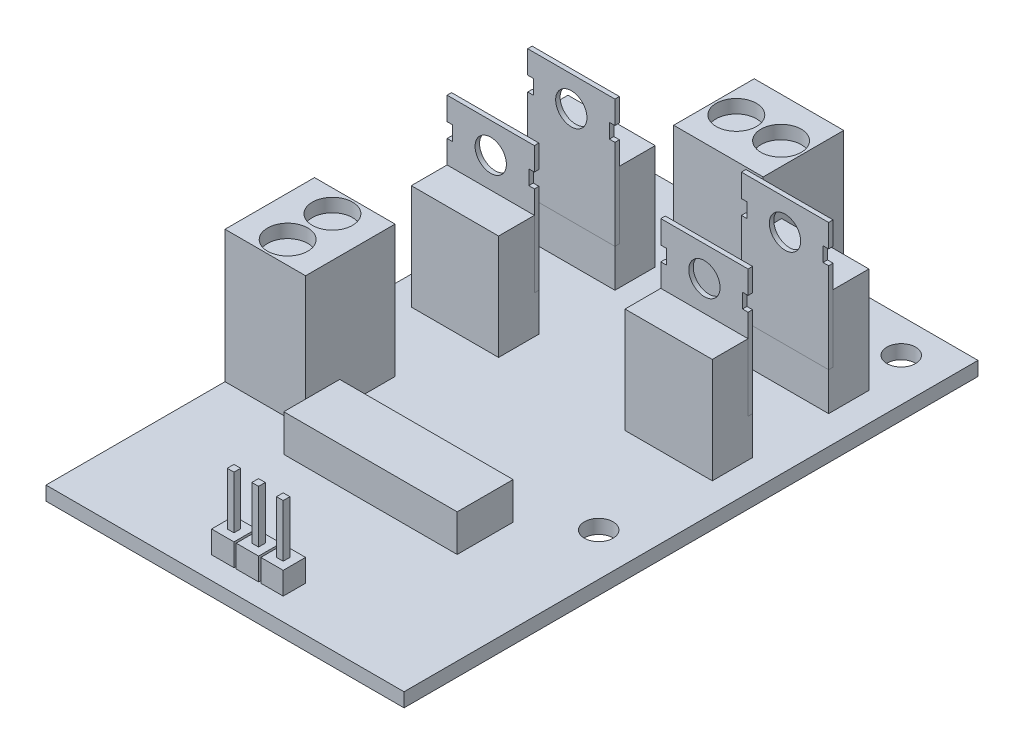
from build123d import *

# Parameters (mm, degrees)
SKETCH1_W           = 40.64
SKETCH1_H           = 65.151
BOSS_EXTRUDE1_DEPTH = 1.5875
SKETCH2_R           = 1.6256
CUT_EXTRUDE1_DEPTH  = 39.426367985
SKETCH3_W           = 9.144
SKETCH3_H           = 10.16
SKETCH3_R           = 2.286
SKETCH3_W_2         = 10.16
SKETCH3_H_2         = 9.144
BOSS_EXTRUDE2_DEPTH = 14.986
CUT_EXTRUDE2_START  = 14.986
SKETCH3_3_R         = 2.286
CUT_EXTRUDE2_DEPTH  = 1.524
SKETCH4_W           = 9.906
SKETCH4_H           = 4.572
BOSS_EXTRUDE3_DEPTH = 11.938
SKETCH5_W           = 9.906
SKETCH5_H           = 7.62
BOSS_EXTRUDE4_DEPTH = 0.508
SKETCH5_3_W         = 9.906
SKETCH5_3_H         = 7.62
CUT_EXTRUDE3_DEPTH  = 0.508
SKETCH6_W           = 2.54
SKETCH6_H           = 2.54
BOSS_EXTRUDE5_DEPTH = 2.54
SKETCH7_W           = 0.762
SKETCH7_H           = 0.762
BOSS_EXTRUDE6_DEPTH = 5.969
SKETCH8_W           = 19.685
SKETCH8_H           = 6.35
BOSS_EXTRUDE7_DEPTH = 4.191


with BuildPart() as part:
    # Sketch1 → Boss-Extrude1 (new body)
    with BuildSketch(Plane(origin=(0, 0, 0), x_dir=(1, 0, 0), z_dir=(0, 1, 0))):
        Rectangle(SKETCH1_W, SKETCH1_H)
    extrude(amount=BOSS_EXTRUDE1_DEPTH)

    # Sketch2 → Cut-Extrude1 (cut, through all)
    with BuildSketch(Plane(origin=(0, 1.5875, 0), x_dir=(1, 0, 0), z_dir=(0, 1, 0))):
        with Locations(Location((-15.0114, 28.7147, 0), (0, 0, 270))):
            Circle(SKETCH2_R)
        with Locations(Location((15.4686, 28.7147, 0), (0, 0, 270))):
            Circle(SKETCH2_R)
        with Locations(Location((15.4686, -5.6261, 0), (0, 0, 270))):
            Circle(SKETCH2_R)
    extrude(amount=-CUT_EXTRUDE1_DEPTH, mode=Mode.SUBTRACT)

    # Sketch6 → Boss-Extrude5 (add)
    with BuildSketch(Plane(origin=(0, 1.5875, 0), x_dir=(1, 0, 0), z_dir=(0, 1, 0))):
        with Locations((0, -28.7655)):
            Rectangle(SKETCH6_W, SKETCH6_H)
        with Locations((2.794, -28.7655)):
            Rectangle(SKETCH6_W, SKETCH6_H)
        with Locations((-2.794, -28.7655)):
            Rectangle(SKETCH6_W, SKETCH6_H)
    extrude(amount=BOSS_EXTRUDE5_DEPTH)

    # Sketch7 → Boss-Extrude6 (add)
    with BuildSketch(Plane(origin=(0, 4.1275, 0), x_dir=(1, 0, 0), z_dir=(0, 1, 0))):
        with Locations((-2.794, -28.7655)):
            Rectangle(SKETCH7_W, SKETCH7_H)
        with Locations((0, -28.7655)):
            Rectangle(SKETCH7_W, SKETCH7_H)
        with Locations((2.794, -28.7655)):
            Rectangle(SKETCH7_W, SKETCH7_H)
    extrude(amount=BOSS_EXTRUDE6_DEPTH)

    # Sketch8 → Boss-Extrude7 (add)
    with BuildSketch(Plane(origin=(0, 1.5875, 0), x_dir=(1, 0, 0), z_dir=(0, 1, 0))):
        with Locations((0, -12.8905)):
            Rectangle(SKETCH8_W, SKETCH8_H)
    extrude(amount=BOSS_EXTRUDE7_DEPTH)


with BuildPart() as body_2:
    # Sketch3 → Boss-Extrude2 (new body)
    # profile 1 of 6: a face of its own
    with BuildSketch(Plane(origin=(0, 1.5875, 0), x_dir=(1, 0, 0), z_dir=(0, 1, 0))):
        with Locations((-15.748, -7.1755)):
            Rectangle(SKETCH3_W, SKETCH3_H)
        with Locations((-15.748, -9.7155)):
            Circle(SKETCH3_R, mode=Mode.SUBTRACT)
        with Locations((-15.748, -4.6355)):
            Circle(SKETCH3_R, mode=Mode.SUBTRACT)
    # profile 2 of 6: a face of its own
    with BuildSketch(Plane(origin=(0, 1.5875, 0), x_dir=(1, 0, 0), z_dir=(0, 1, 0))):
        with Locations((-15.748, -4.6355)):
            Circle(SKETCH3_R)
    # profile 3 of 6: a face of its own
    with BuildSketch(Plane(origin=(0, 1.5875, 0), x_dir=(1, 0, 0), z_dir=(0, 1, 0))):
        with Locations((-15.748, -9.7155)):
            Circle(SKETCH3_R)
    # profile 4 of 6: a face of its own
    with BuildSketch(Plane(origin=(0, 1.5875, 0), x_dir=(1, 0, 0), z_dir=(0, 1, 0))):
        with Locations((0, 28.0035)):
            Rectangle(SKETCH3_W_2, SKETCH3_H_2)
        with Locations((-2.54, 28.0035)):
            Circle(SKETCH3_R, mode=Mode.SUBTRACT)
        with Locations((2.54, 28.0035)):
            Circle(SKETCH3_R, mode=Mode.SUBTRACT)
    # profile 5 of 6: a face of its own
    with BuildSketch(Plane(origin=(0, 1.5875, 0), x_dir=(1, 0, 0), z_dir=(0, 1, 0))):
        with Locations((2.54, 28.0035)):
            Circle(SKETCH3_R)
    # profile 6 of 6: a face of its own
    with BuildSketch(Plane(origin=(0, 1.5875, 0), x_dir=(1, 0, 0), z_dir=(0, 1, 0))):
        with Locations((-2.54, 28.0035)):
            Circle(SKETCH3_R)
    extrude(amount=BOSS_EXTRUDE2_DEPTH)

    # Sketch3<3> → Cut-Extrude2 (cut)
    with BuildSketch(Plane(origin=(0, 1.5875, 0), x_dir=(1, 0, 0), z_dir=(0, 1, 0)).offset(CUT_EXTRUDE2_START)):
        with Locations(Location((-15.748, -9.7155, 0), (0, 0, 270))):
            Circle(SKETCH3_3_R)
        with Locations(Location((-15.748, -4.6355, 0), (0, 0, 270))):
            Circle(SKETCH3_3_R)
        with Locations(Location((2.54, 28.0035, 0), (0, 0, 270))):
            Circle(SKETCH3_3_R)
        with Locations(Location((-2.54, 28.0035, 0), (0, 0, 270))):
            Circle(SKETCH3_3_R)
    extrude(amount=-CUT_EXTRUDE2_DEPTH, mode=Mode.SUBTRACT)


with BuildPart() as body_3:
    # Sketch4 → Boss-Extrude3 (new body)
    with BuildSketch(Plane(origin=(0, 1.5875, 0), x_dir=(1, 0, 0), z_dir=(0, 1, 0))):
        with Locations((-12.1285, 21.1455)):
            Rectangle(SKETCH4_W, SKETCH4_H)
    extrude(amount=BOSS_EXTRUDE3_DEPTH)

    # Sketch5<3> → Cut-Extrude3 (cut)
    with BuildSketch(Plane.XY.offset(-18.8595)):
        with Locations((-12.1285, 9.7155)):
            Rectangle(SKETCH5_3_W, SKETCH5_3_H)
    extrude(amount=-CUT_EXTRUDE3_DEPTH, mode=Mode.SUBTRACT)


with BuildPart() as body_4:
    # Sketch5 → Boss-Extrude4 (new body)
    with BuildSketch(Plane.XY.offset(-18.8595)):
        with BuildLine():
            Line((-17.0815, 13.5255), (-7.1755, 13.5255))
            Line((-7.1755, 13.5255), (-10.666642283, 15.942444658))
            ThreePointArc((-10.666642283, 15.942444658), (-13.140555342, 15.492642283), (-13.590357717, 17.966555342))
            Line((-13.590357717, 17.966555342), (-17.0815, 20.3835))
            Line((-17.0815, 20.3835), (-17.0815, 17.78))
            Line((-17.0815, 17.78), (-16.4465, 17.78))
            Line((-16.4465, 17.78), (-16.4465, 16.129))
            Line((-16.4465, 16.129), (-17.0815, 16.129))
            Line((-17.0815, 16.129), (-17.0815, 13.5255))
        make_face()
        with BuildLine():
            Line((-10.666642283, 15.942444658), (-7.1755, 13.5255))
            Line((-7.1755, 13.5255), (-7.1755, 16.129))
            Line((-7.1755, 16.129), (-7.8105, 16.129))
            Line((-7.8105, 16.129), (-7.8105, 17.78))
            Line((-7.8105, 17.78), (-7.1755, 17.78))
            Line((-7.1755, 17.78), (-7.1755, 20.3835))
            Line((-7.1755, 20.3835), (-17.0815, 20.3835))
            Line((-17.0815, 20.3835), (-13.590357717, 17.966555342))
            ThreePointArc((-13.590357717, 17.966555342), (-11.598358047, 18.651625072), (-10.3505, 16.9545))
            ThreePointArc((-10.3505, 16.9545), (-10.431374928, 16.424358047), (-10.666642283, 15.942444658))
        make_face()
        with Locations((-12.1285, 9.7155)):
            Rectangle(SKETCH5_W, SKETCH5_H)
    extrude(amount=-BOSS_EXTRUDE4_DEPTH)


with BuildPart() as body_5:
    # Mirror5: mirrored copy
    add(body_3.part.mirror(Plane(origin=(0, 0, 0), x_dir=(0, 0, 1), z_dir=(1, 0, 0))))


with BuildPart() as body_6:
    # Mirror5 2: mirrored copy
    add(body_4.part.mirror(Plane(origin=(0, 0, 0), x_dir=(0, 0, 1), z_dir=(1, 0, 0))))


with BuildPart() as body_7:
    # Mirror6: mirrored copy
    add(body_3.part.mirror(Plane.XY.offset(-14.5415)))


with BuildPart() as body_8:
    # Mirror6 2: mirrored copy
    add(body_4.part.mirror(Plane.XY.offset(-14.5415)))


with BuildPart() as body_9:
    # Mirror6 3: mirrored copy
    add(body_6.part.mirror(Plane.XY.offset(-14.5415)))


with BuildPart() as body_10:
    # Mirror6 4: mirrored copy
    add(body_5.part.mirror(Plane.XY.offset(-14.5415)))


solid = Compound([part.part, body_2.part, body_3.part, body_4.part, body_5.part, body_6.part, body_7.part, body_8.part, body_9.part, body_10.part])
